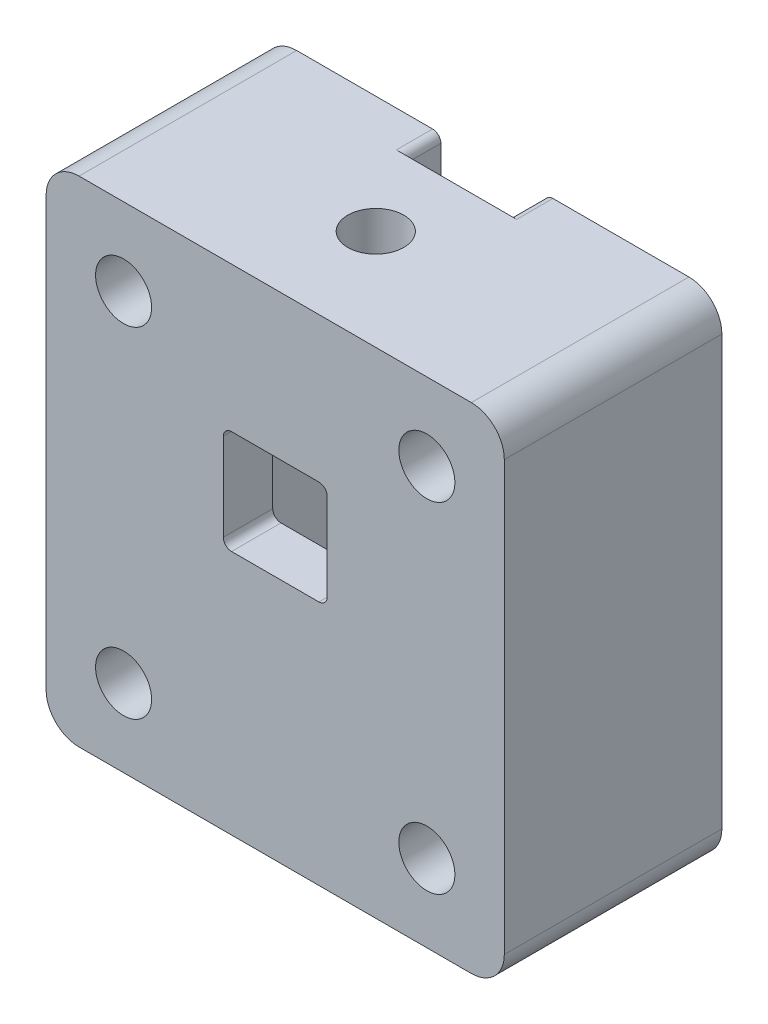
from build123d import *

# Parameters (mm, degrees)
SKETCH2_W               = 27.8
SKETCH2_H               = 13.2
BOSS_EXTRUDE1_DEPTH     = 15
SKETCH7_R               = 1.7
CUT_EXTRUDE1_DEPTH      = 25.340295808
MIRROR2_COPY_1_SKETCH_R = 1.7
MIRROR2_COPY_1_DEPTH    = 25.340295808
SKETCH8_W               = 8.3
SKETCH8_H               = 10.2
CUT_EXTRUDE2_DEPTH      = 21.2
CUT_EXTRUDE5_START      = 1
CUT_EXTRUDE5_DEPTH      = 6.3
SKETCH12_W              = 6.3
SKETCH12_H              = 6.3
CUT_EXTRUDE6_DEPTH      = 23.852789764
FILLET4_R               = 0.5
FILLET3_R               = 2
FILLET5_R               = 0.5
SKETCH13_R              = 1.7
CUT_EXTRUDE7_DEPTH      = 27.195610319


with BuildPart() as part:
    # Sketch2 → Boss-Extrude1 (new, symmetric)
    with BuildSketch(Plane(origin=(0, 0, 0), x_dir=(1, 0, 0), z_dir=(0, 1, 0))):
        Rectangle(SKETCH2_W, SKETCH2_H)
    extrude(amount=BOSS_EXTRUDE1_DEPTH, both=True)

    # Sketch7 → Cut-Extrude1 (cut, through all)
    with BuildSketch(Plane.XY.offset(6.6)):
        with Locations((-9.2, 10.3)):
            Circle(SKETCH7_R)
    cut_extrude1 = extrude(amount=-CUT_EXTRUDE1_DEPTH, mode=Mode.SUBTRACT)

    # Mirror1: Cut-Extrude1 across plane
    add(cut_extrude1.mirror(Plane(origin=(0, 0, 0), x_dir=(0, 0, 1), z_dir=(1, 0, 0))), mode=Mode.SUBTRACT)

    # Mirror2: Cut-Extrude1 across plane
    add(cut_extrude1.mirror(Plane.ZX), mode=Mode.SUBTRACT)

    # Mirror2 copy 1 sketch → Mirror2 copy 1 (cut, through all)
    with BuildSketch(Plane(origin=(0, 0, 6.6), x_dir=(-1, 0, 0), z_dir=(0, 0, 1))):
        with Locations((-9.2, 10.3)):
            Circle(MIRROR2_COPY_1_SKETCH_R)
    extrude(amount=-MIRROR2_COPY_1_DEPTH, mode=Mode.SUBTRACT)

    # Sketch8 → Cut-Extrude2 (cut)
    with BuildSketch(Plane.XZ.offset(15)):
        with Locations((0, -1.5)):
            Rectangle(SKETCH8_W, SKETCH8_H)
    extrude(amount=-CUT_EXTRUDE2_DEPTH, mode=Mode.SUBTRACT)

    # Sketch11 → Cut-Extrude5 (cut)
    with BuildSketch(Plane.ZY.offset(-4.15).offset(CUT_EXTRUDE5_START)):
        Polygon((-11.6, 15), (-4.4, 15), (-4.4, 14.2), (-3.8, 14.2), (-3.8, 13), (-4.4, 13), (-4.4, 12.2), (-3.8, 12.2), (-3.8, 11), (-4.4, 11), (-4.4, 10.2), (-3.8, 10.2), (-3.8, 9), (-4.4, 9), (-4.4, 8.2), (-3.8, 8.2), (-3.8, 7), (-4.4, 7), (-4.4, 6.2), (-11.6, 6.2), align=None)
    extrude(amount=CUT_EXTRUDE5_DEPTH, mode=Mode.SUBTRACT)

    # Sketch12 → Cut-Extrude6 (cut, through all)
    with BuildSketch(Plane(origin=(0, 0, 3.6), x_dir=(-1, 0, 0), z_dir=(0, 0, -1))):
        with Locations((0, 3.05)):
            Rectangle(SKETCH12_W, SKETCH12_H)
    extrude(amount=-CUT_EXTRUDE6_DEPTH, mode=Mode.SUBTRACT)

    # Fillet4
    fillet4_edges = [part.edges().sort_by_distance(p)[0] for p in [
        (-3.15, 6.2, 5.1),
        (-3.15, -0.1, 5.1),
        (3.15, -0.1, 5.1),
        (3.15, 6.2, 5.1),
    ]]
    fillet(fillet4_edges, radius=FILLET4_R)

    # Fillet3
    fillet3_edges = [part.edges().sort_by_distance(p)[0] for p in [
        (-13.9, 15, 0),
        (13.9, 15, 0),
        (-13.9, -15, 0),
        (13.9, -15, 0),
    ]]
    fillet(fillet3_edges, radius=FILLET3_R)

    # Fillet5
    fillet5_edges = [part.edges().sort_by_distance(p)[0] for p in [
        (4.15, -15, -1.5),
        (-4.15, -15, -1.5),
        (-3.15, 6.2, -5.5),
        (3.15, 6.2, -5.5),
        (3.15, 15, -5.5),
        (-3.15, 15, -5.5),
    ]]
    fillet(fillet5_edges, radius=FILLET5_R)

    # Sketch13 → Cut-Extrude7 (cut, through all)
    with BuildSketch(Plane.XZ.offset(-6.2)):
        with Locations(Location((0, 0.5, 0), (0, 0, 270))):
            Circle(SKETCH13_R)
    extrude(amount=-CUT_EXTRUDE7_DEPTH, mode=Mode.SUBTRACT)


solid = part.part
